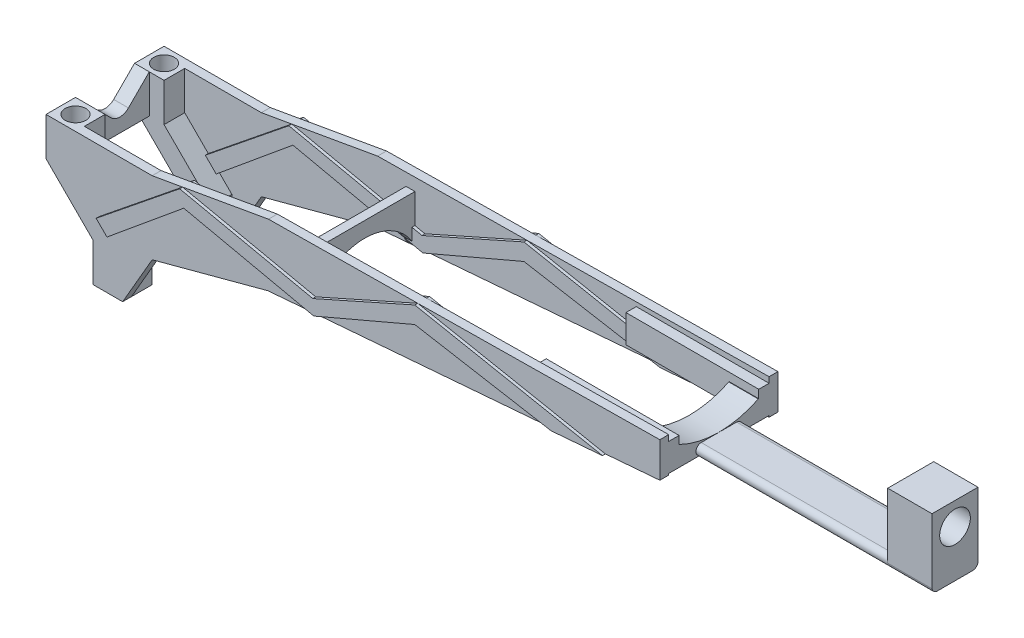
from build123d import *

# Parameters (mm, degrees)
EXTRUDE_1_DEPTH       = 5
SKETCH_2_R            = 1.75
CUT_EXTRUDE_1_DEPTH   = 15
EXTRUDE_2_DEPTH       = 1.5
EXTRUDE_9_DEPTH       = 0.5
EXTRUDE_9_DEPTH_BACK  = 2
SKETCH_3_R            = 1.75
CUT_EXTRUDE_6_DEPTH   = 6.5
EXTRUDE_10_DEPTH      = 5
CUT_EXTRUDE_7_DEPTH   = 15
EXTRUDE_11_DEPTH      = 1.5
EXTRUDE_12_DEPTH      = 0.5
EXTRUDE_12_DEPTH_BACK = 2
SKETCH_17_R           = 1.75
CUT_EXTRUDE_8_DEPTH   = 6.5
EXTRUDE_13_DEPTH      = 2.5
EXTRUDE_14_DEPTH      = 1.5
EXTRUDE_15_DEPTH      = 5
SKETCH_24_4_W         = 1.75
SKETCH_24_4_H         = 3.342366724
EXTRUDE_16_DEPTH      = 22.5
EXTRUDE_17_DEPTH      = 40
SKETCH_28_W           = 3.461866643
SKETCH_28_H           = 8.544861576
SKETCH_28_W_2         = 3.380090265
SKETCH_28_H_2         = 8.552455592
CUT_EXTRUDE_9_DEPTH   = 35
EXTRUDE_18_DEPTH      = 10
EXTRUDE_18_DEPTH_BACK = 1
SKETCH_30_W           = 7.5
SKETCH_30_H           = 7.790021452
SKETCH_31_R           = 2.6
CUT_EXTRUDE_10_DEPTH  = 7.5


with BuildPart() as part:
    # 草图1 → 凸台-拉伸1 (new body)
    with BuildSketch(Plane.XY):
        Polygon((0, 0), (0, -6.5), (7.990306627, -14.490306627), (7.990306627, -20.990306627), (12.990306627, -20.990306627), (12.990306627, -14.490306627), (5, -6.5), (5, 0), align=None)
    extrude(amount=EXTRUDE_1_DEPTH)

    # 草图2 → 切除-拉伸1 (cut)
    with BuildSketch(Plane(origin=(0, 0, 0), x_dir=(1, 0, 0), z_dir=(0, 1, 0))):
        with Locations(Location((2.5, -2.5, 0), (0, 0, 270))):
            Circle(SKETCH_2_R)
    extrude(amount=-CUT_EXTRUDE_1_DEPTH, mode=Mode.SUBTRACT)



with BuildPart() as body_2:
    # 草图5 → 凸台-拉伸2 (new body)
    with BuildSketch(Plane.XY.offset(5)):
        Polygon((12.990306627, -14.490306627), (12.990306627, -20.990306627), (17.990306627, -12.33005259), (37.59310092, -7.077499689), (107.04245202, -1.432133489), (107.04245202, 4.307731787), (37.686461688, 3.472963553), (17.990306627, 0), (5, 0), (5, -6.5), align=None)
    extrude(amount=-EXTRUDE_2_DEPTH)


with BuildPart() as part_1:
    add(part.part)

    add(body_2.part)  # 凸台-拉伸9 merges body 2
    # 草图5<8> → 凸台-拉伸9 (add, two sides: drawn at the far end of the back side and taken through both)
    with BuildSketch(Plane.XY.offset(5).offset(-EXTRUDE_9_DEPTH_BACK)):
        Polygon((8.995153314, -10.495153314), (10.83005259, -12.33005259), (23.838077825, -1.590678088), (45.865929556, -6.405021885), (62.974730369, 0.907823357), (86.070137471, -3.136921133), (87.899311972, -2.988232057), (94.779335732, -2.42897192), (62.974730369, 3.777332985), (45.698525456, -3.919808084), (23.138828729, 0.907823357), align=None)
    extrude(amount=EXTRUDE_9_DEPTH + EXTRUDE_9_DEPTH_BACK)

    # 草图3 → 切除-拉伸6 (cut)
    with BuildSketch(Plane.XZ.offset(20.990306627)):
        with Locations(Location((10.490306627, 2.5, 0), (0, 0, 270))):
            Circle(SKETCH_3_R)
    extrude(amount=-CUT_EXTRUDE_6_DEPTH, mode=Mode.SUBTRACT)



with BuildPart() as body_2_2:
    # 草图15 → 凸台-拉伸10 (new body)
    with BuildSketch(Plane(origin=(0, 0, -10), x_dir=(-1, 0, 0), z_dir=(0, 0, -1))):
        Polygon((-12.990306627, -20.990306627), (-7.990306627, -20.990306627), (-7.990306627, -14.490306627), (0, -6.5), (0, 0), (-5, 0), (-5, -6.5), (-12.990306627, -14.490306627), align=None)
    extrude(amount=EXTRUDE_10_DEPTH)

    # 草图16 → 切除-拉伸7 (cut)
    with BuildSketch(Plane(origin=(0, 0, 0), x_dir=(1, 0, 0), z_dir=(0, 1, 0))):
        with BuildLine():
            ThreePointArc((3.737436867, 13.737436867), (2.5, 14.25), (1.262563133, 13.737436867))
            Line((1.262563133, 13.737436867), (2.5, 12.5))
            Line((2.5, 12.5), (3.737436867, 13.737436867))
        make_face()
        with BuildLine():
            Line((2.5, 12.5), (1.262563133, 13.737436867))
            ThreePointArc((1.262563133, 13.737436867), (0.75, 12.5), (1.262563133, 11.262563133))
            Line((1.262563133, 11.262563133), (2.5, 12.5))
        make_face()
        with BuildLine():
            Line((3.737436867, 13.737436867), (2.5, 12.5))
            Line((2.5, 12.5), (3.737436867, 11.262563133))
            ThreePointArc((3.737436867, 11.262563133), (4.116789182, 11.830303993), (4.25, 12.5))
            ThreePointArc((4.25, 12.5), (4.116789182, 13.169696007), (3.737436867, 13.737436867))
        make_face()
        with BuildLine():
            Line((3.737436867, 11.262563133), (2.5, 12.5))
            Line((2.5, 12.5), (1.262563133, 11.262563133))
            ThreePointArc((1.262563133, 11.262563133), (2.5, 10.75), (3.737436867, 11.262563133))
        make_face()
    extrude(amount=-CUT_EXTRUDE_7_DEPTH, mode=Mode.SUBTRACT)

    # 草图18 → 凸台-拉伸11 (add)
    with BuildSketch(Plane(origin=(0, 0, -15), x_dir=(-1, 0, 0), z_dir=(0, 0, -1))):
        Polygon((-107.04245202, -1.432133489), (-94.779335732, -2.42897192), (-62.974730369, 3.777332985), (-107.04245202, 4.307731787), align=None)
        Polygon((-86.070137471, -3.136921133), (-45.865929556, -6.405021885), (-62.974730369, 0.907823357), align=None)
        Polygon((-45.698525456, -3.919808084), (-23.138828729, 0.907823357), (-37.686461688, 3.472963553), (-62.974730369, 3.777332985), align=None)
        Polygon((-23.138828729, 0.907823357), (-8.995153314, -10.495153314), (-5, -6.5), (-5, 0), (-17.990306627, 0), align=None)
        Polygon((-17.990306627, -12.33005259), (-12.990306627, -20.990306627), (-12.990306627, -14.490306627), (-10.83005259, -12.33005259), (-23.838077825, -1.590678088), (-45.865929556, -6.405021885), (-37.59310092, -7.077499689), align=None)
    extrude(amount=-EXTRUDE_11_DEPTH)


with BuildPart() as extrude_11_piece_1:
    # of the separate pieces the step leaves, piece 1, a body of its own (extrude_11_pieces)
    add(body_2_2.part.solids().sort_by_distance((12.990306627, -20.990306627, -10))[0])



with BuildPart() as extrude_11_piece_2:
    # of the separate pieces the step leaves, piece 2, a body of its own (extrude_11_pieces)
    add(body_2_2.part.solids().sort_by_distance((94.779335732, -2.42897192, -15))[0])


with BuildPart() as extrude_11_piece_3:
    # of the separate pieces the step leaves, piece 3, a body of its own (extrude_11_pieces)
    add(body_2_2.part.solids().sort_by_distance((37.686461688, 3.472963553, -15))[0])


with BuildPart() as extrude_11_piece_4:
    # of the separate pieces the step leaves, piece 4, a body of its own (extrude_11_pieces)
    add(body_2_2.part.solids().sort_by_distance((86.070137471, -3.136921133, -15))[0])


with BuildPart() as extrude_11_piece_1_1:
    add(extrude_11_piece_1.part)

    add(extrude_11_piece_2.part)  # 凸台-拉伸12 merges 凸台-拉伸11 piece 2

    add(extrude_11_piece_3.part)  # 凸台-拉伸12 merges 凸台-拉伸11 piece 3

    add(extrude_11_piece_4.part)  # 凸台-拉伸12 merges 凸台-拉伸11 piece 4
    # 草图18<3> → 凸台-拉伸12 (add, two sides: drawn at the far end of the back side and taken through both)
    with BuildSketch(Plane(origin=(0, 0, -15), x_dir=(-1, 0, 0), z_dir=(0, 0, -1)).offset(-EXTRUDE_12_DEPTH_BACK)):
        Polygon((-23.838077825, -1.590678088), (-10.83005259, -12.33005259), (-8.995153314, -10.495153314), (-23.138828729, 0.907823357), (-45.698525456, -3.919808084), (-62.974730369, 3.777332985), (-94.779335732, -2.42897192), (-86.070137471, -3.136921133), (-62.974730369, 0.907823357), (-45.865929556, -6.405021885), align=None)
    extrude(amount=EXTRUDE_12_DEPTH + EXTRUDE_12_DEPTH_BACK)

    # 草图17 → 切除-拉伸8 (cut)
    with BuildSketch(Plane.XZ.offset(20.990306627)):
        with Locations(Location((10.490306627, -12.5, 0), (0, 0, 270))):
            Circle(SKETCH_17_R)
    extrude(amount=-CUT_EXTRUDE_8_DEPTH, mode=Mode.SUBTRACT)


with BuildPart() as part_2:
    add(part_1.part)

    add(extrude_11_piece_1_1.part)  # 凸台-拉伸13 merges 凸台-拉伸11 piece 1
    # 草图19 → 凸台-拉伸13 (add)
    with BuildSketch(Plane.ZY):
        with BuildLine():
            Line((-10, 0), (-6.464466094, -3.535533906))
            ThreePointArc((-6.464466094, -3.535533906), (-5, -4.142135624), (-3.535533906, -3.535533906))
            Line((-3.535533906, -3.535533906), (0, 0))
            Line((0, 0), (0, -6.5))
            Line((0, -6.5), (-10, -6.5))
            Line((-10, -6.5), (-10, 0))
        make_face()
    extrude(amount=-EXTRUDE_13_DEPTH)

    # 草图21 → 凸台-拉伸14 (add)
    with BuildSketch(Plane(origin=(42.5, 0, 0), x_dir=(0, 0, -1), z_dir=(1, 0, 0))):
        with BuildLine():
            Line((13.5, 1.437799149), (-3.5, 1.437799149))
            Line((-3.5, 1.437799149), (-3.5, -6.533909198))
            ThreePointArc((-3.5, -6.533909198), (5, -1.158347274), (13.5, -6.533909198))
            Line((13.5, -6.533909198), (13.5, 1.437799149))
        make_face()
    extrude(amount=EXTRUDE_14_DEPTH)



with BuildPart() as body_2_3:
    # 草图24 → 凸台-拉伸15 (new body)
    with BuildSketch(Plane(origin=(104, 0, 0), x_dir=(0, 0, -1), z_dir=(1, 0, 0))):
        with BuildLine():
            Line((-1.675753423, 1.910233235), (-1.75, 1.910233235))
            Line((-1.75, 1.910233235), (-1.75, -1.432133489))
            Line((-1.75, -1.432133489), (11.75, -1.432133489))
            Line((11.75, -1.432133489), (11.75, 1.910233235))
            Line((11.75, 1.910233235), (11.675753423, 1.910233235))
            ThreePointArc((11.675753423, 1.910233235), (5, 0.365220302), (-1.675753423, 1.910233235))
        make_face()
    extrude(amount=-EXTRUDE_15_DEPTH)


with BuildPart() as part_3:
    add(part_2.part)

    add(body_2_3.part)  # 凸台-拉伸16 merges body 2 3
    # 草图24<4> → 凸台-拉伸16 (add)
    with BuildSketch(Plane(origin=(104, 0, 0), x_dir=(0, 0, -1), z_dir=(1, 0, 0))):
        with BuildLine():
            Line((-3.5, 3.274439584), (-3.5, 2.96507449))
            ThreePointArc((-3.5, 2.96507449), (-2.641979316, 2.426754732), (-1.75, 1.946795821))
            Line((-1.75, 1.946795821), (-1.75, 3.274439584))
            Line((-1.75, 3.274439584), (-3.5, 3.274439584))
        make_face()
        with BuildLine():
            Line((-3.5, 2.96507449), (-3.5, 1.910233235))
            Line((-3.5, 1.910233235), (-1.75, 1.910233235))
            Line((-1.75, 1.910233235), (-1.75, 1.946795821))
            ThreePointArc((-1.75, 1.946795821), (-2.641979316, 2.426754732), (-3.5, 2.96507449))
        make_face()
        with Locations((-2.625, 0.239049873)):
            Rectangle(SKETCH_24_4_W, SKETCH_24_4_H)
        with Locations((12.625, 0.239049873)):
            Rectangle(SKETCH_24_4_W, SKETCH_24_4_H)
        with BuildLine():
            Line((13.5, 1.910233235), (13.5, 2.96507449))
            ThreePointArc((13.5, 2.96507449), (12.641979316, 2.426754732), (11.75, 1.946795821))
            Line((11.75, 1.946795821), (11.75, 1.910233235))
            Line((11.75, 1.910233235), (13.5, 1.910233235))
        make_face()
        with BuildLine():
            ThreePointArc((11.75, 1.946795821), (12.641979316, 2.426754732), (13.5, 2.96507449))
            Line((13.5, 2.96507449), (13.5, 3.299190827))
            Line((13.5, 3.299190827), (11.75, 3.299190827))
            Line((11.75, 3.299190827), (11.75, 1.946795821))
        make_face()
    extrude(amount=-EXTRUDE_16_DEPTH)

    # 草图26 → 凸台-拉伸17 (add)
    with BuildSketch(Plane(origin=(104, 0, 0), x_dir=(0, 0, -1), z_dir=(1, 0, 0))):
        with BuildLine():
            Line((2, 0.357887963), (8, 0.357887963))
            ThreePointArc((8, 0.357887963), (8.895010726, -0.537122763), (8, -1.432133489))
            Line((8, -1.432133489), (2, -1.432133489))
            ThreePointArc((2, -1.432133489), (1.104989274, -0.537122763), (2, 0.357887963))
        make_face()
    extrude(amount=EXTRUDE_17_DEPTH)

    # 草图28 → 切除-拉伸9 (cut)
    with BuildSketch(Plane(origin=(104, 0, 0), x_dir=(0, 0, -1), z_dir=(1, 0, 0))):
        with Locations((-4.57289023, 0.313738206)):
            Rectangle(SKETCH_28_W, SKETCH_28_H)
        with Locations((14.303823551, 0.282682405)):
            Rectangle(SKETCH_28_W_2, SKETCH_28_H_2)
    extrude(amount=CUT_EXTRUDE_9_DEPTH, mode=Mode.SUBTRACT)

    # 草图30 → 凸台-拉伸18 (add, two sides: drawn at the far end of the back side and taken through both)
    with BuildSketch(Plane(origin=(0, 0.357887963, 0), x_dir=(1, 0, 0), z_dir=(0, 1, 0)).offset(-EXTRUDE_18_DEPTH_BACK)):
        with Locations((140.25, 5)):
            Rectangle(SKETCH_30_W, SKETCH_30_H)
    extrude(amount=EXTRUDE_18_DEPTH + EXTRUDE_18_DEPTH_BACK)

    # 草图31 → 切除-拉伸10 (cut)
    with BuildSketch(Plane.ZY.offset(-136.5)):
        with Locations((-5, 6.5)):
            Circle(SKETCH_31_R)
    extrude(amount=-CUT_EXTRUDE_10_DEPTH, mode=Mode.SUBTRACT)


solid = part_3.part
